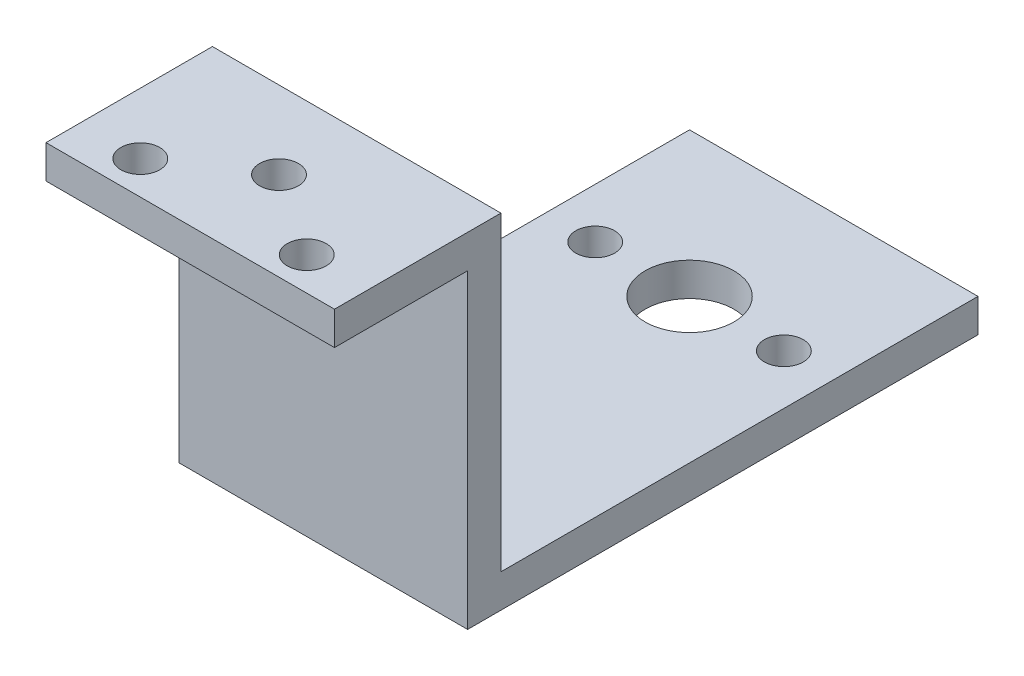
from build123d import *

# Parameters (mm, degrees)
SKETCH_1_R          = 4
SKETCH_1_R_2        = 1.75
EXTRUDE_1_DEPTH     = 3
EXTRUDE_2_DEPTH     = 26
CUT_EXTRUDE_1_DEPTH = 55.571054599
EXTRUDE_4_DEPTH     = 3


with BuildPart() as part:
    # 草图1 → 凸台-拉伸1 (new body)
    with BuildSketch(Plane(origin=(0, 0, 0), x_dir=(1, 0, 0), z_dir=(0, 1, 0))):
        with BuildLine():
            Line((-13, 0), (-13, -30))
            Line((-13, -30), (13, -30))
            Line((13, -30), (13, 0))
            ThreePointArc((13, 0), (0, 13), (-13, 0))
        make_face()
        with Locations(Location((0, 0, 0), (0, 0, 270))):
            Circle(SKETCH_1_R, mode=Mode.SUBTRACT)
        with Locations(Location((8.5, 0, 0), (0, 0, 270))):
            Circle(SKETCH_1_R_2, mode=Mode.SUBTRACT)
        with Locations(Location((-8.5, 0, 0), (0, 0, 270))):
            Circle(SKETCH_1_R_2, mode=Mode.SUBTRACT)
    extrude(amount=EXTRUDE_1_DEPTH)

    # 草图4 → 凸台-拉伸2 (add)
    with BuildSketch(Plane(origin=(13, 0, 0), x_dir=(0, 0, -1), z_dir=(1, 0, 0))):
        Polygon((-30, 3), (-30, 31), (-45, 31), (-45, 28), (-33, 28), (-33, 0), (-30, 0), align=None)
    extrude(amount=-EXTRUDE_2_DEPTH)

    # 草图6 → 切除-拉伸1 (cut, through all)
    with BuildSketch(Plane.XZ.offset(-28)):
        with BuildLine():
            ThreePointArc((9.25, 42), (7.5, 43.75), (5.75, 42))
            Line((5.75, 42), (7.5, 42))
            Line((7.5, 42), (7.5, 40.25))
            ThreePointArc((7.5, 40.25), (8.737436867, 40.762563133), (9.25, 42))
        make_face()
        with BuildLine():
            Line((7.5, 42), (5.75, 42))
            ThreePointArc((5.75, 42), (6.262563133, 40.762563133), (7.5, 40.25))
            Line((7.5, 40.25), (7.5, 42))
        make_face()
        with BuildLine():
            ThreePointArc((1.75, 37), (0, 38.75), (-1.75, 37))
            Line((-1.75, 37), (1.75, 37))
        make_face()
        with BuildLine():
            Line((1.75, 37), (-1.75, 37))
            ThreePointArc((-1.75, 37), (0, 35.25), (1.75, 37))
        make_face()
        with BuildLine():
            Line((-7.5, 40.25), (-7.5, 42))
            Line((-7.5, 42), (-5.75, 42))
            ThreePointArc((-5.75, 42), (-8.737436867, 43.237436867), (-7.5, 40.25))
        make_face()
        with BuildLine():
            Line((-5.75, 42), (-7.5, 42))
            Line((-7.5, 42), (-7.5, 40.25))
            ThreePointArc((-7.5, 40.25), (-6.262563133, 40.762563133), (-5.75, 42))
        make_face()
    extrude(amount=-CUT_EXTRUDE_1_DEPTH, mode=Mode.SUBTRACT)

    # 草图7 → 凸台-拉伸4 (add)
    with BuildSketch(Plane.XZ):
        with BuildLine():
            ThreePointArc((-6.7e-08, -13), (-9.192388179, -9.192388132), (-13, 0))
            Line((-13, 0), (-13, -13))
            Line((-13, -13), (-6.7e-08, -13))
        make_face()
        with BuildLine():
            ThreePointArc((13, 0), (9.192388132, -9.192388179), (-6.7e-08, -13))
            Line((-6.7e-08, -13), (13, -13))
            Line((13, -13), (13, 0))
        make_face()
    extrude(amount=-EXTRUDE_4_DEPTH)


solid = part.part
